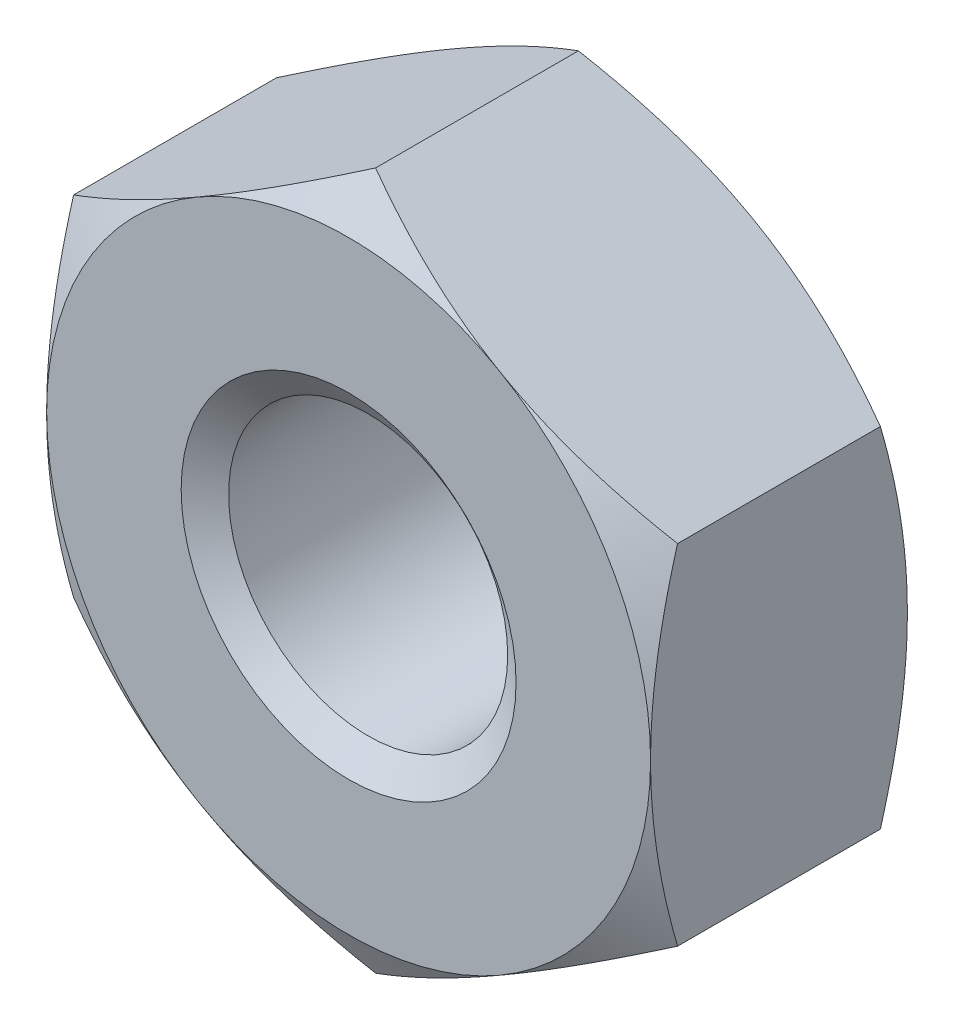
from build123d import *

# Parameters (mm, degrees)
BASENUTSKE_R  = 1.25
BASENUT_DEPTH = 2.3


with BuildPart() as part:
    # BaseNutSke → BaseNut (new body)
    with BuildSketch(Plane.XY):
        Polygon((2.705, 1.561732478), (2.705, -1.561732478), (0, -3.123464956), (-2.705, -1.561732478), (-2.705, 1.561732478), (0, 3.123464956), align=None)
        Circle(BASENUTSKE_R, mode=Mode.SUBTRACT)
    extrude(amount=-BASENUT_DEPTH)

    # Sketch3 → Double-Chamfer (revolve, cut)
    with BuildSketch(Plane(origin=(0, 0, 0), x_dir=(0, 0, -1), z_dir=(1, 0, 0))):
        Polygon((2.3, 2.705), (2.058399145, 3.123464956), (2.058399145, 13.123464956), (12.3, 13.123464956), (12.3, 2.705), align=None)
        Polygon((0.241600855, 13.123464956), (-10, 13.123464956), (-10, 2.705), (0, 2.705), (0.241600855, 3.123464956), align=None)
    revolve(axis=Axis((0, 0, 0), (0, 0, -1)), mode=Mode.SUBTRACT)

    # Sketch5 (on Right Plane) → EndChamfer (revolve, cut)
    with BuildSketch(Plane(origin=(0, 0, 0), x_dir=(0, 0, -1), z_dir=(1, 0, 0)), mode=Mode.PRIVATE) as endchamfer_sk:
        Polygon((2.2746, 1.5), (2.082042927, 1.225), (2.3254, 1.225), (2.3254, 1.5), align=None)
        Polygon((-0.0508, 1.5), (0, 1.5), (0.192557073, 1.225), (-0.0508, 1.225), align=None)
    revolve(endchamfer_sk.sketch.rotate(Axis((0, 0, -25.037505729), (0, 0, -1)), 90), axis=Axis((0, 0, -25.037505729), (0, 0, -1)), mode=Mode.SUBTRACT)


solid = part.part
